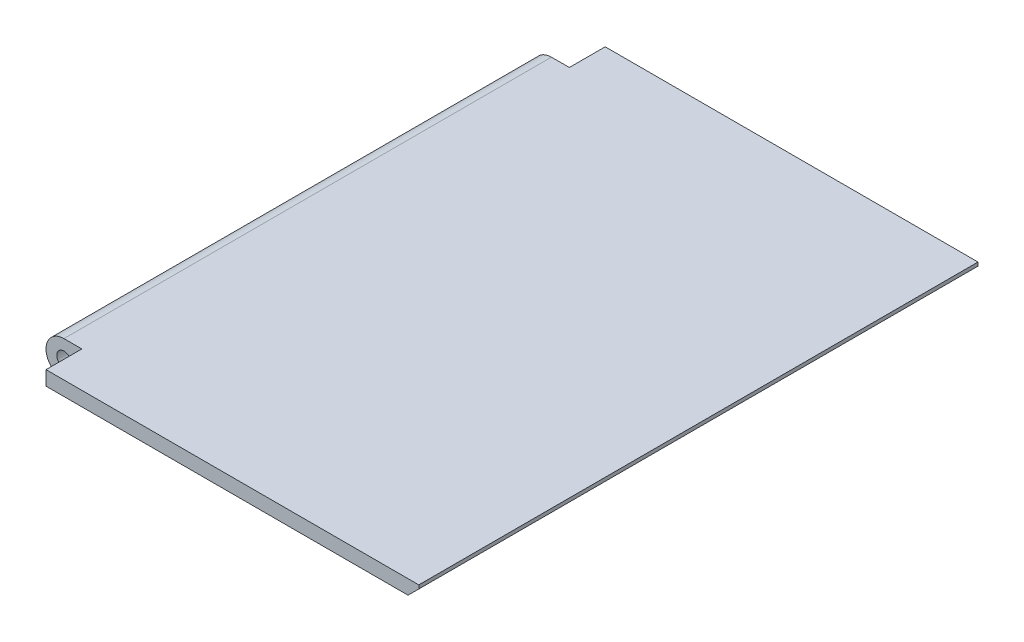
from build123d import *

# Parameters (mm, degrees)
SKETCH1_R           = 2
BOSS_EXTRUDE1_DEPTH = 136
SKETCH2_W           = 104
SKETCH2_H           = 4
BOSS_EXTRUDE2_DEPTH = 10
SKETCH3_W           = 104
SKETCH3_H           = 4
BOSS_EXTRUDE3_DEPTH = 10
CUT_EXTRUDE2_DEPTH  = 191.373317458


with BuildPart() as part:
    # Sketch1 → Boss-Extrude1 (new body)
    with BuildSketch(Plane.XY):
        with BuildLine():
            Line((0, 5), (109, 5))
            Line((109, 5), (109, 1))
            Line((109, 1), (4.898979486, 1))
            ThreePointArc((4.898979486, 1), (-3.16227766, -3.872983346), (0, 5))
        make_face()
        Circle(SKETCH1_R, mode=Mode.SUBTRACT)
    extrude(amount=BOSS_EXTRUDE1_DEPTH)

    # Sketch2 → Boss-Extrude2 (add)
    with BuildSketch(Plane.XY.offset(136)):
        with Locations((57, 3)):
            Rectangle(SKETCH2_W, SKETCH2_H)
    extrude(amount=BOSS_EXTRUDE2_DEPTH)

    # Sketch3 → Boss-Extrude3 (add)
    with BuildSketch(Plane(origin=(0, 0, 0), x_dir=(-1, 0, 0), z_dir=(0, 0, -1))):
        with Locations((-57, 3)):
            Rectangle(SKETCH3_W, SKETCH3_H)
    extrude(amount=BOSS_EXTRUDE3_DEPTH)

    # Sketch5 → Cut-Extrude2 (cut, through all)
    with BuildSketch(Plane.XY.offset(146)):
        Polygon((106, 1), (109, 4), (109, 1), align=None)
    extrude(amount=-CUT_EXTRUDE2_DEPTH, mode=Mode.SUBTRACT)


solid = part.part
